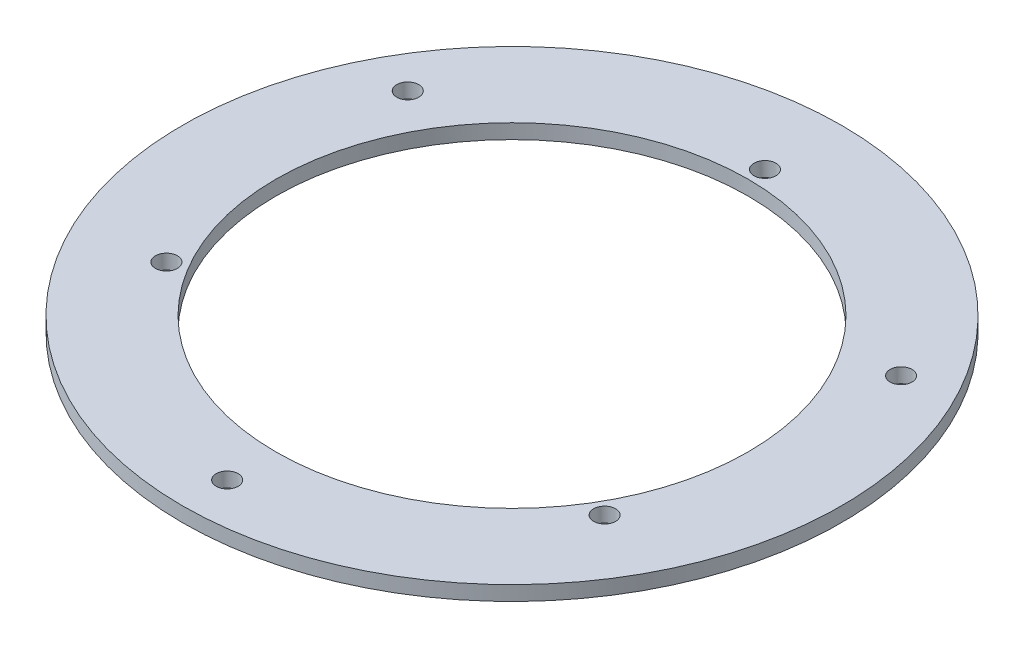
from build123d import *

# Parameters (mm, degrees)
SKETCH2_R           = 45
SKETCH2_R_2         = 1.5
SKETCH2_R_3         = 32.25
BOSS_EXTRUDE1_DEPTH = 2


with BuildPart() as part:
    # Sketch2 → Boss-Extrude1 (new body)
    with BuildSketch(Plane(origin=(0, 0, 0), x_dir=(1, 0, 0), z_dir=(0, 1, 0))):
        with Locations(Location((0, 0, 0), (0, 0, 270))):
            Circle(SKETCH2_R)
        with Locations(Location((0, 34.543876, 0), (0, 0, 270))):
            Circle(SKETCH2_R_2, mode=Mode.SUBTRACT)
        with Locations(Location((-29.915874161, -17.271938, 0), (0, 0, 270))):
            Circle(SKETCH2_R_2, mode=Mode.SUBTRACT)
        with Locations(Location((29.915874161, -17.271938, 0), (0, 0, 270))):
            Circle(SKETCH2_R_2, mode=Mode.SUBTRACT)
        with Locations(Location((33.680334171, 19.44535, 0), (0, 0, 270))):
            Circle(SKETCH2_R_2, mode=Mode.SUBTRACT)
        with Locations(Location((-33.680334171, 19.44535, 0), (0, 0, 270))):
            Circle(SKETCH2_R_2, mode=Mode.SUBTRACT)
        with Locations(Location((0, -38.8907, 0), (0, 0, 270))):
            Circle(SKETCH2_R_2, mode=Mode.SUBTRACT)
        with Locations(Location((0, 0, 0), (0, 0, 270))):
            Circle(SKETCH2_R_3, mode=Mode.SUBTRACT)
    extrude(amount=BOSS_EXTRUDE1_DEPTH)


solid = part.part
